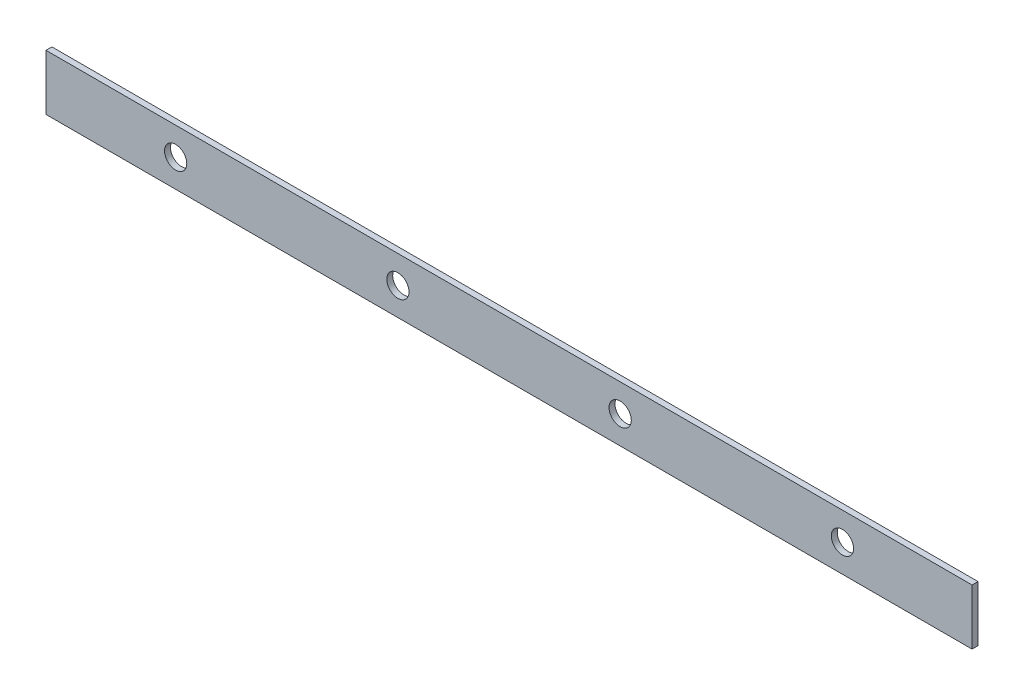
from build123d import *

# Parameters (mm, degrees)
MODEL_W         = 250
MODEL_H         = 15
MODEL_R         = 3
EXTRUDE_1_DEPTH = 1.6


with BuildPart() as part:
    # Model → Бобышка-Вытянуть1 (new body)
    with BuildSketch(Plane.XY):
        with Locations((125, 7.5)):
            Rectangle(MODEL_W, MODEL_H)
        with Locations((215, 7.5)):
            Circle(MODEL_R, mode=Mode.SUBTRACT)
        with Locations((95, 7.5)):
            Circle(MODEL_R, mode=Mode.SUBTRACT)
        with Locations((35, 7.5)):
            Circle(MODEL_R, mode=Mode.SUBTRACT)
        with Locations((155, 7.5)):
            Circle(MODEL_R, mode=Mode.SUBTRACT)
    extrude(amount=-EXTRUDE_1_DEPTH)


solid = part.part
